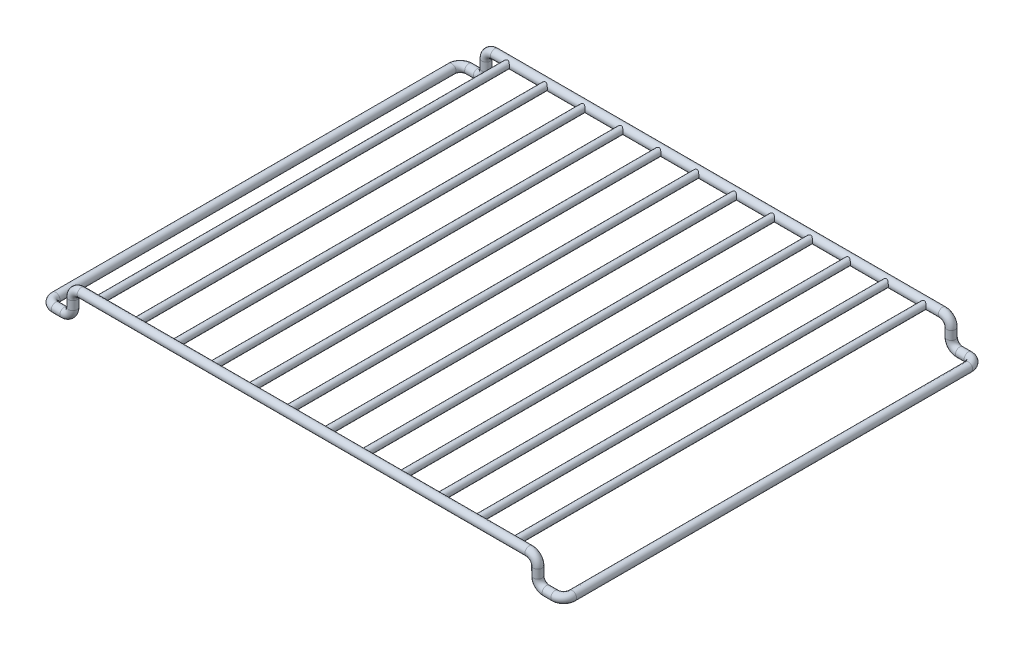
from build123d import *

# Parameters (mm, degrees)
SKETCH_1_R             = 2.5
EXTRUDE_1_REACH        = 289
EXTRUDE_1_END_RADIUS   = 2.5
SKETCH_3_R             = 2
PATTERN_LINEAR_1_COUNT = 6
PATTERN_LINEAR_1_PITCH = 22


with BuildPart() as part:
    # По траектории1: sweep along a curve in space
    with BuildLine() as sweep_1_path:
        Line((0, 0, 0), (130, 0, 0))
        ThreePointArc((130, 0, 0), (133.535533906, -1.464466094, 0), (135, -5, 0))
        Line((135, -5, 0), (135, -10, 0))
        ThreePointArc((135, -10, 0), (136.464466094, -13.535533906, 0), (140, -15, 0))
        Line((140, -15, 0), (145, -15, 0))
        ThreePointArc((145, -15, 0), (148.535533906, -15, -1.464466094), (150, -15, -5))
        Line((150, -15, -5), (150, -15, -235))
        ThreePointArc((150, -15, -235), (148.535533906, -15, -238.535533906), (145, -15, -240))
        Line((145, -15, -240), (140, -15, -240))
        ThreePointArc((140, -15, -240), (136.464466094, -13.535533906, -240), (135, -10, -240))
        Line((135, -10, -240), (135, -5, -240))
        ThreePointArc((135, -5, -240), (133.535533906, -1.464466094, -240), (130, 0, -240))
        Line((130, 0, -240), (0, 0, -240))
    # Эскиз1 → По траектории1 (sweep)
    with BuildSketch(Plane(origin=(0, 0, 0), x_dir=(0, 0, -1), z_dir=(1, 0, 0))):
        Circle(SKETCH_1_R)
    sweep(path=sweep_1_path.line)

    # Бобышка-Вытянуть1: up to this cylinder (the profile starts outside it)
    extrude_1_end = Plane(origin=(11, 0, -240), z_dir=(-1, 0, 0)) * Cylinder(EXTRUDE_1_END_RADIUS, 584, mode=Mode.PRIVATE)
    # Эскиз3 → Бобышка-Вытянуть1 (add, up to the surface)
    with BuildSketch(Plane.XY, mode=Mode.PRIVATE) as extrude_1_sk1:
        with Locations((11, 0)):
            Circle(SKETCH_3_R)
    extrude_1_tool1 = extrude(extrude_1_sk1.sketch, amount=-EXTRUDE_1_REACH, mode=Mode.PRIVATE) - extrude_1_end
    extrude_1 = extrude_1_tool1.solids().sort_by_distance((11, 0, 0))[0]
    add(extrude_1)

    # Линейный массив1: Бобышка-Вытянуть1 ×6
    with Locations(*[(i * PATTERN_LINEAR_1_PITCH, 0, 0) for i in range(1, PATTERN_LINEAR_1_COUNT)]):
        add(extrude_1)

    # Зеркальное отражение1: part across plane


with BuildPart() as part_1:
    add(part.part)
    add(part.part.mirror(Plane(origin=(0, 0, 0), x_dir=(0, 0, 1), z_dir=(1, 0, 0))))


solid = part_1.part
